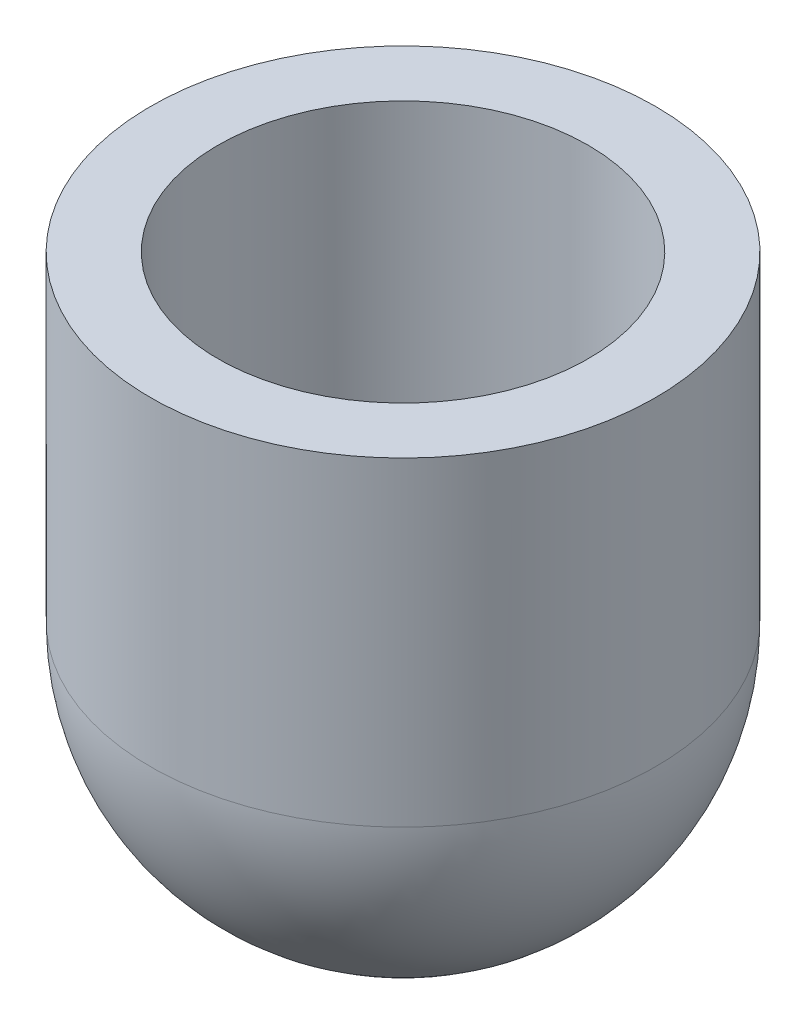
from build123d import *


with BuildPart() as part:
    # Sketch1 → Revolve1 (revolve)
    with BuildSketch(Plane.XY, mode=Mode.PRIVATE) as revolve1_sk:
        with BuildLine():
            Line((-7.5, 0), (-7.5, -9.5))
            ThreePointArc((-7.5, -9.5), (-5.303300859, -14.803300859), (0, -17))
            Line((0, -17), (0, -15))
            ThreePointArc((0, -15), (-3.889087297, -13.389087297), (-5.5, -9.5))
            Line((-5.5, -9.5), (-5.5, 0))
            Line((-5.5, 0), (-7.5, 0))
        make_face()
    revolve(revolve1_sk.sketch.rotate(Axis((0, -17, 0), (0, 1, 0)), 270), axis=Axis((0, -17, 0), (0, 1, 0)))


solid = part.part
